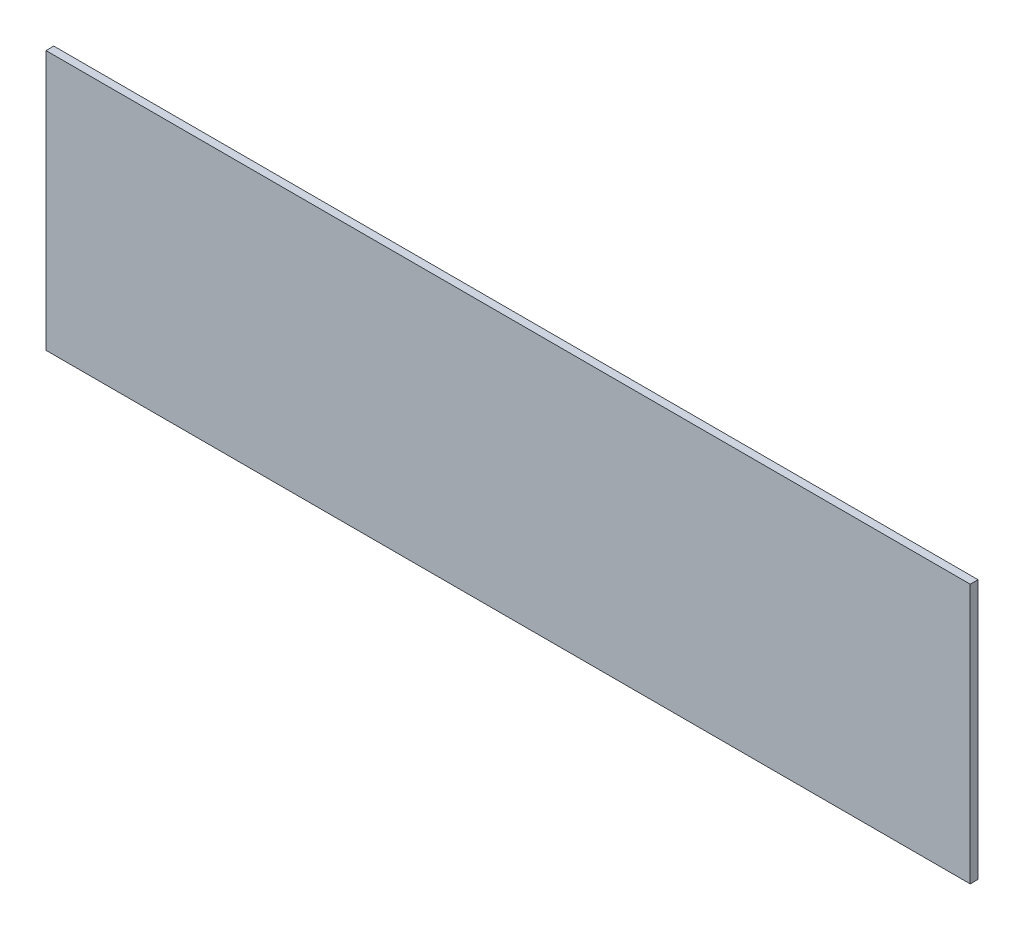
from build123d import *

# Parameters (mm, degrees)
ESQUISSE1_W        = 356
ESQUISSE1_H        = 100
BOSS_EXTRU_1_DEPTH = 3


with BuildPart() as part:
    # Esquisse1 → Boss.-Extru.1 (new body)
    with BuildSketch(Plane.XY):
        with Locations((-9.802898551, 33.066666667)):
            Rectangle(ESQUISSE1_W, ESQUISSE1_H)
    extrude(amount=BOSS_EXTRU_1_DEPTH)


solid = part.part
